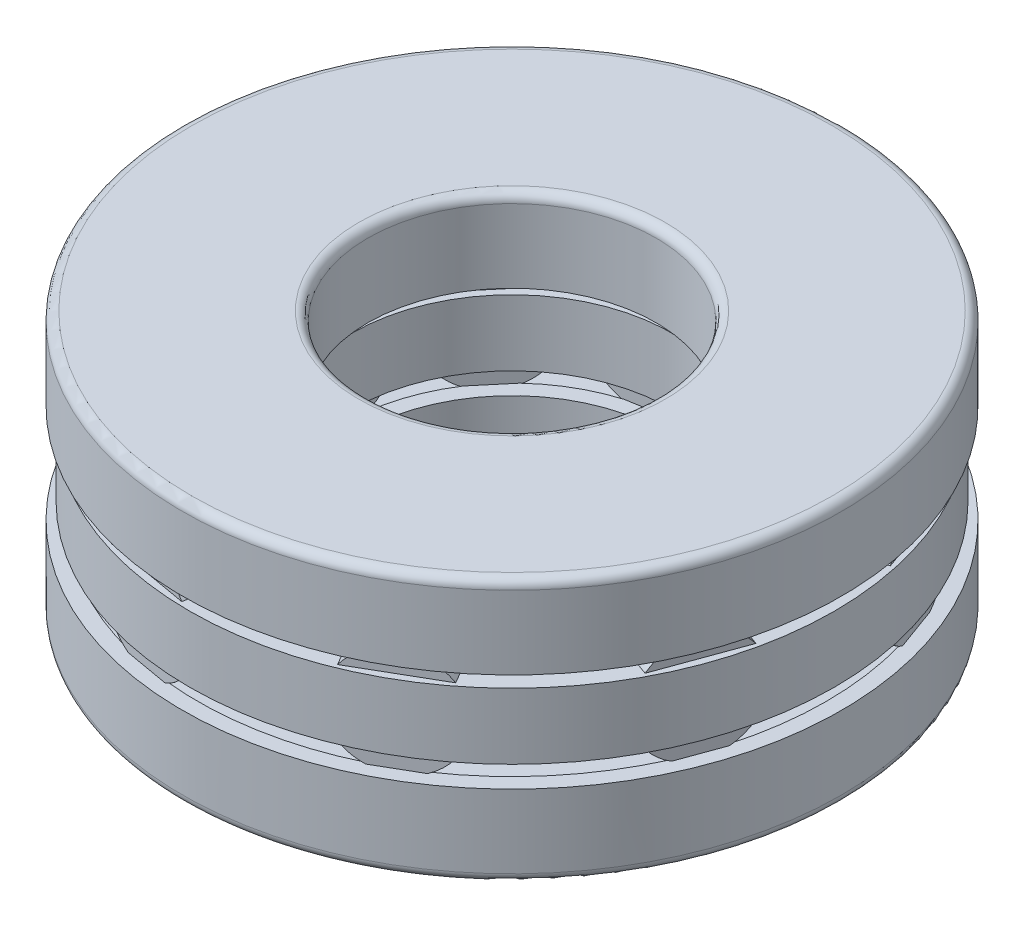
from build123d import *

# Parameters (mm, degrees)
SKETCH6_W                 = 8.6
SKETCH6_H                 = 6.6
SKETCH7_W                 = 19.78
SKETCH7_H                 = 8
SKETCH10_W                = 8.6
SKETCH10_H                = 6.6
PATTERN_ROLLER_COUNT      = 9
COSMETIC_FILLET_OUTER_1_R = 1.1
COSMETIC_FILLET_OUTER_2_R = 1.1
COSMETIC_FILLET_INNER_1_R = 1.1
COSMETIC_FILLET_INNER_2_R = 1.1


with BuildPart() as part:
    # Sketch6 → Body-Roller (revolve)
    with BuildSketch(Plane.XY, mode=Mode.PRIVATE) as body_roller_sk:
        with Locations((-33.98, 3.3)):
            Rectangle(SKETCH6_W, SKETCH6_H)
    body_roller = revolve(body_roller_sk.sketch.rotate(Axis((-38.28, 0, 0), (1, 0, 0)), 90), axis=Axis((-38.28, 0, 0), (1, 0, 0)))

    # Sketch7 → Body-Roller-Cage (revolve)
    with BuildSketch(Plane.XY):
        with Locations((-29.25, 0)):
            Rectangle(SKETCH7_W, SKETCH7_H)
    revolve(axis=Axis((0, 16, 0), (0, -1, 0)))

    # Sketch10 → Body-Roller-2 (revolve)
    with BuildSketch(Plane.XY):
        with Locations((-24.52, 3.3)):
            Rectangle(SKETCH10_W, SKETCH10_H)
    body_roller_2 = revolve(axis=Axis((-28.82, 0, 0), (1, 0, 0)))

    # Pattern-Roller: Body-Roller, Body-Roller-2 ×9 about axis
    pattern_roller_axis = Axis((0, 0, 0), (0, 1, 0))
    add([body_roller.rotate(pattern_roller_axis, i * 360 / PATTERN_ROLLER_COUNT) for i in range(1, PATTERN_ROLLER_COUNT)])
    add([body_roller_2.rotate(pattern_roller_axis, i * 360 / PATTERN_ROLLER_COUNT) for i in range(1, PATTERN_ROLLER_COUNT)])

    # Sketch8 → Body-Lower (revolve)
    with BuildSketch(Plane.XY):
        Polygon((-20.367538268, -6), (-20.367538268, -6.452461732), (-28.672461732, -6.452461732), (-28.672461732, -6), (-29.827538268, -6), (-29.827538268, -6.452461732), (-38.132461732, -6.452461732), (-38.132461732, -6), (-40, -6), (-40, -16), (-18.5, -16), (-18.5, -6), align=None)
    revolve(axis=Axis((0, 16, 0), (0, -1, 0)))

    # Sketch9 → Body-Upper (revolve)
    with BuildSketch(Plane.XY):
        Polygon((-20.367538268, 6.452461732), (-20.367538268, 6), (-17.5, 6), (-17.5, 16), (-40, 16), (-40, 6), (-38.132461732, 6), (-38.132461732, 6.452461732), (-29.827538268, 6.452461732), (-29.827538268, 6), (-28.672461732, 6), (-28.672461732, 6.452461732), align=None)
    revolve(axis=Axis((0, 16, 0), (0, -1, 0)))

    # Cosmetic-Fillet-Outer-1
    cosmetic_fillet_outer_1_edges = [part.edges().sort_by_distance(p)[0] for p in [
        (40, 16, 0),
    ]]
    fillet(cosmetic_fillet_outer_1_edges, radius=COSMETIC_FILLET_OUTER_1_R)

    # Cosmetic-Fillet-Outer-2
    cosmetic_fillet_outer_2_edges = [part.edges().sort_by_distance(p)[0] for p in [
        (40, -16, 0),
    ]]
    fillet(cosmetic_fillet_outer_2_edges, radius=COSMETIC_FILLET_OUTER_2_R)

    # Cosmetic-Fillet-Inner-1
    cosmetic_fillet_inner_1_edges = [part.edges().sort_by_distance(p)[0] for p in [
        (17.5, 16, 0),
    ]]
    fillet(cosmetic_fillet_inner_1_edges, radius=COSMETIC_FILLET_INNER_1_R)

    # Cosmetic-Fillet-Inner-2
    cosmetic_fillet_inner_2_edges = [part.edges().sort_by_distance(p)[0] for p in [
        (18.5, -16, 0),
    ]]
    fillet(cosmetic_fillet_inner_2_edges, radius=COSMETIC_FILLET_INNER_2_R)


solid = part.part
